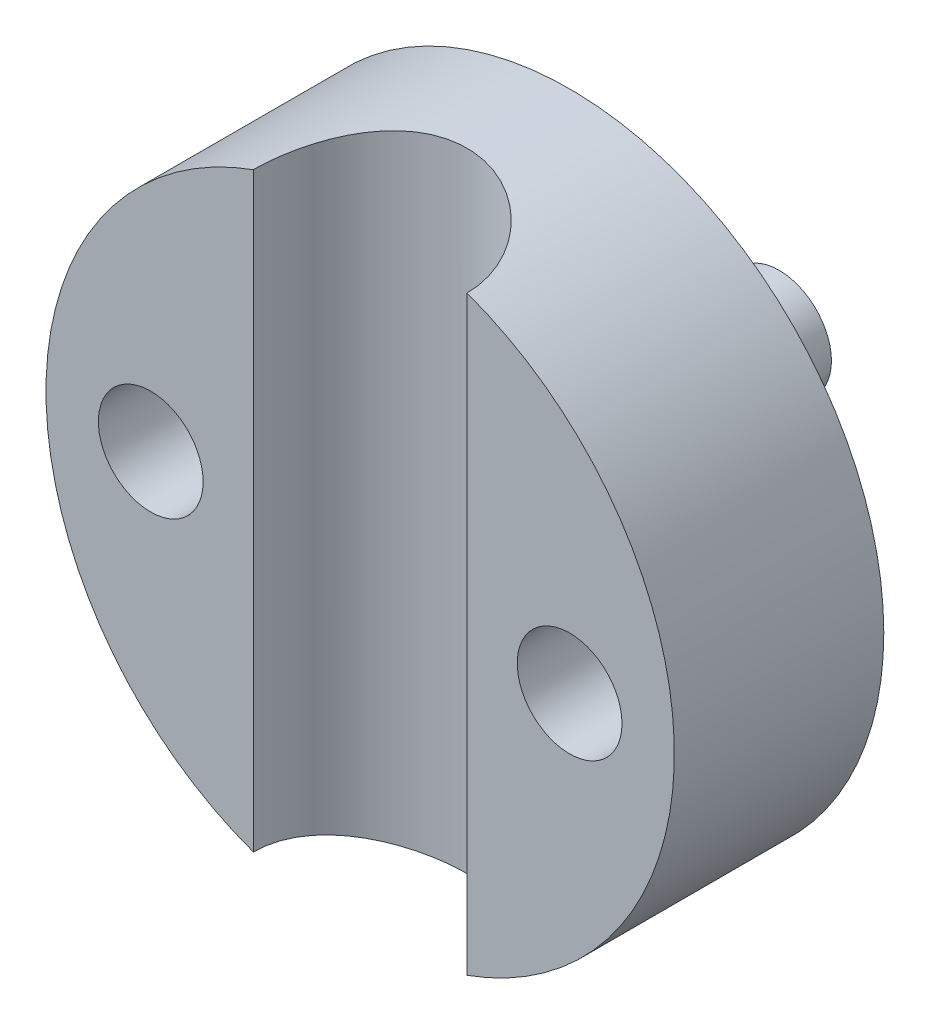
from build123d import *

# Parameters (mm, degrees)
SKETCH1_R               = 19.05
BOSS_EXTRUDE1_DEPTH     = 12.7
SKETCH2_R               = 3.175
BOSS_EXTRUDE2_DEPTH     = 12.7
CUT_EXTRUDE1_DEPTH      = 30.784140075
CUT_EXTRUDE1_DEPTH_BACK = 30.784140075
SKETCH4_R               = 6.477
SKETCH5_R               = 3.175
CUT_EXTRUDE2_DEPTH      = 73.66


with BuildPart() as part:
    # Sketch1 → Boss-Extrude1 (new body)
    with BuildSketch(Plane.XY):
        Circle(SKETCH1_R)
    extrude(amount=BOSS_EXTRUDE1_DEPTH)

    # Sketch2 → Boss-Extrude2 (add)
    with BuildSketch(Plane(origin=(0, 0, 0), x_dir=(-1, 0, 0), z_dir=(0, 0, -1))):
        with Locations(Location((0, 0, 0), (0, 0, 180))):
            Circle(SKETCH2_R)
    extrude(amount=BOSS_EXTRUDE2_DEPTH)

    # Sketch4 → Cut-Extrude1 (cut, two sides: drawn at the far end of the back side and taken through both)
    with BuildSketch(Plane(origin=(0, 0, 0), x_dir=(1, 0, 0), z_dir=(0, 1, 0)).offset(-CUT_EXTRUDE1_DEPTH_BACK)):
        with Locations((0, -12.7)):
            Circle(SKETCH4_R)
    extrude(amount=CUT_EXTRUDE1_DEPTH + CUT_EXTRUDE1_DEPTH_BACK, mode=Mode.SUBTRACT)

    # Sketch5 → Cut-Extrude2 (cut)
    with BuildSketch(Plane.XY.offset(12.7)):
        with Locations((12.7, 0)):
            Circle(SKETCH5_R)
        with Locations((-12.7, 0)):
            Circle(SKETCH5_R)
    extrude(amount=-CUT_EXTRUDE2_DEPTH, mode=Mode.SUBTRACT)


solid = part.part
